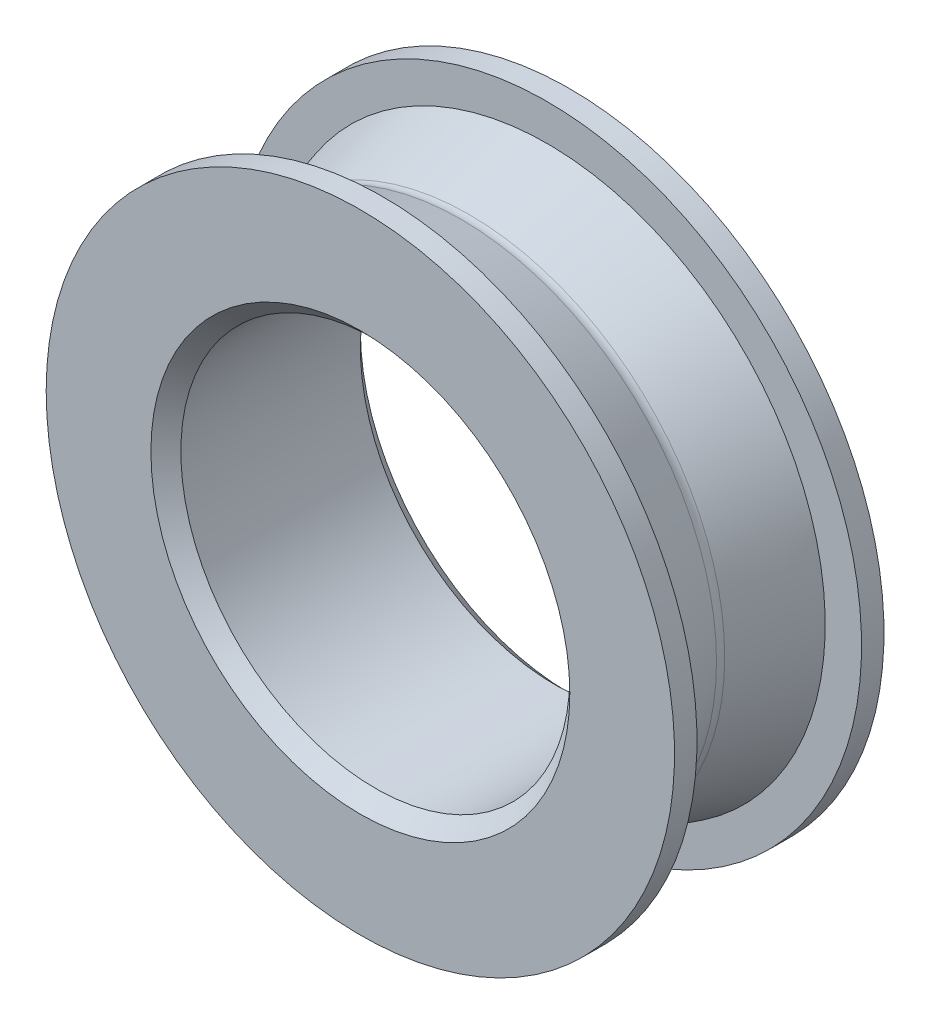
from build123d import *

# Parameters (mm, degrees)
SKETCH1_R           = 19
SKETCH1_R_2         = 13
BOSS_EXTRUDE1_DEPTH = 14
SKETCH3_R           = 21
SKETCH3_R_2         = 13
BOSS_EXTRUDE2_DEPTH = 1.5
FILLET1_R           = 1
CHAMFER2_SIZE       = 1


with BuildPart() as part:
    # Sketch1 → Boss-Extrude1 (new body)
    with BuildSketch(Plane.XY):
        Circle(SKETCH1_R)
        Circle(SKETCH1_R_2, mode=Mode.SUBTRACT)
    extrude(amount=BOSS_EXTRUDE1_DEPTH)

    # Sketch2 → Cut-Revolve1 (revolve, cut)
    with BuildSketch(Plane(origin=(0, 0, 0), x_dir=(1, 0, 0), z_dir=(0, 1, 0))):
        Polygon((-19, 0), (-17, -7), (-19, -14), align=None)
    revolve(axis=Axis((0, 0, 0), (0, 0, 1)), mode=Mode.SUBTRACT)

    # Sketch3 → Boss-Extrude2 (add)
    with BuildSketch(Plane(origin=(0, 0, 0), x_dir=(-1, 0, 0), z_dir=(0, 0, -1))):
        Circle(SKETCH3_R)
        with Locations(Location((0, 0, 0), (0, 0, 180))):
            Circle(SKETCH3_R_2, mode=Mode.SUBTRACT)
    boss_extrude2 = extrude(amount=-BOSS_EXTRUDE2_DEPTH)

    # Mirror1: Boss-Extrude2 across plane
    add(boss_extrude2.mirror(Plane.XY.offset(7)))

    # Fillet1
    fillet1_edges = [part.edges().sort_by_distance(p)[0] for p in [
        (17, 0, 7),
    ]]
    fillet(fillet1_edges, radius=FILLET1_R)

    # Chamfer2
    chamfer2_edges = [part.edges().sort_by_distance(p)[0] for p in [
        (-13, 0, 0),
        (-13, 0, 14),
    ]]
    chamfer(chamfer2_edges, length=CHAMFER2_SIZE)


solid = part.part
